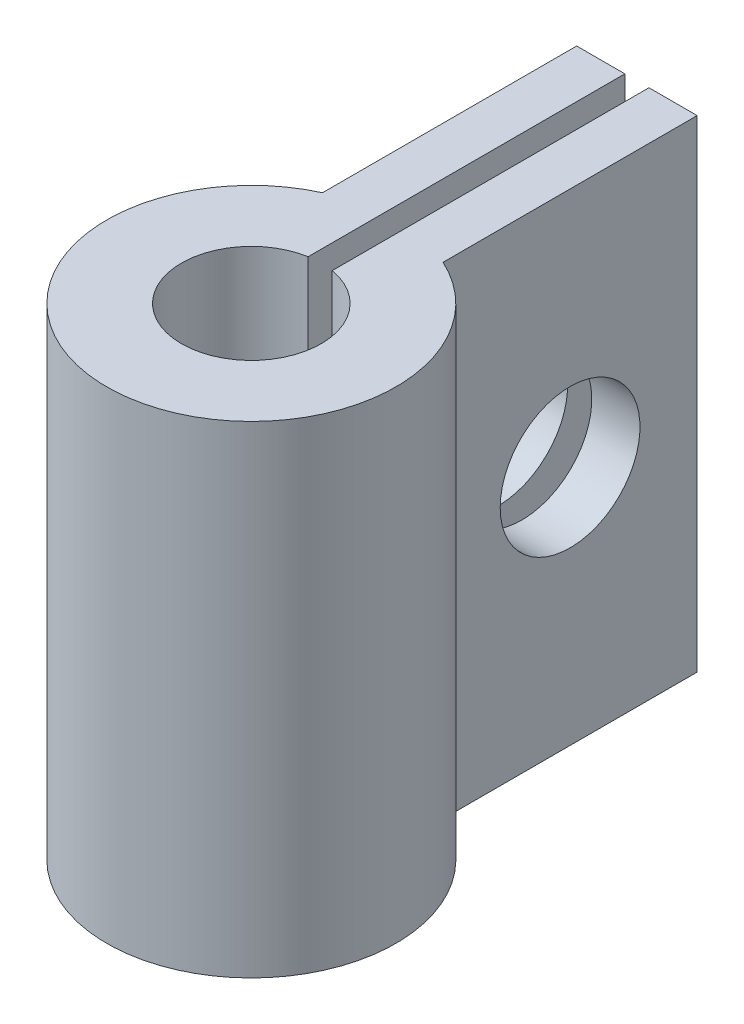
from build123d import *

# Parameters (mm, degrees)
SKETCH1_R           = 6
BOSS_EXTRUDE1_DEPTH = 20
SKETCH3_R           = 2.9
CUT_EXTRUDE1_DEPTH  = 26
BOSS_EXTRUDE2_DEPTH = 2
BOSS_EXTRUDE3_DEPTH = 2
SKETCH6_W           = 1
SKETCH6_H           = 20
CUT_EXTRUDE2_DEPTH  = 17
SKETCH7_R           = 2.9
CUT_EXTRUDE3_DEPTH  = 17


with BuildPart() as part:
    # Sketch1 → Boss-Extrude1 (new body)
    with BuildSketch(Plane(origin=(0, 0, 0), x_dir=(1, 0, 0), z_dir=(0, 1, 0))):
        with Locations(Location((0, 0, 0), (0, 0, 270))):
            Circle(SKETCH1_R)
    extrude(amount=BOSS_EXTRUDE1_DEPTH)

    # Sketch3 → Cut-Extrude1 (cut)
    with BuildSketch(Plane(origin=(0, 20, 0), x_dir=(1, 0, 0), z_dir=(0, 1, 0))):
        with Locations(Location((0, 0, 0), (0, 0, 270))):
            Circle(SKETCH3_R)
    extrude(amount=-CUT_EXTRUDE1_DEPTH, mode=Mode.SUBTRACT)

    # Sketch4 → Boss-Extrude2 (add)
    with BuildSketch(Plane(origin=(-2.5, 0, 0), x_dir=(0, 0, -1), z_dir=(1, 0, 0))):
        Polygon((6, 20), (16, 20), (16, 0), (6, 0), (4.545153511, 0), (4.545153511, 20), align=None)
    extrude(amount=BOSS_EXTRUDE2_DEPTH)

    # Sketch5 → Boss-Extrude3 (add)
    with BuildSketch(Plane(origin=(2.5, 0, 0), x_dir=(0, 0, -1), z_dir=(1, 0, 0))):
        Polygon((6, 20), (16, 20), (16, 0), (6, 0), (4.211348031, 0), (4.211348031, 20), align=None)
    extrude(amount=-BOSS_EXTRUDE3_DEPTH)

    # Sketch6 → Cut-Extrude2 (cut)
    with BuildSketch(Plane(origin=(0, 0, -16), x_dir=(-1, 0, 0), z_dir=(0, 0, -1))):
        with Locations((0, 10)):
            Rectangle(SKETCH6_W, SKETCH6_H)
    extrude(amount=-CUT_EXTRUDE2_DEPTH, mode=Mode.SUBTRACT)

    # Sketch7 → Cut-Extrude3 (cut)
    with BuildSketch(Plane.ZY.offset(2.5)):
        with Locations((-10.727178029, 10)):
            Circle(SKETCH7_R)
    extrude(amount=-CUT_EXTRUDE3_DEPTH, mode=Mode.SUBTRACT)


solid = part.part
